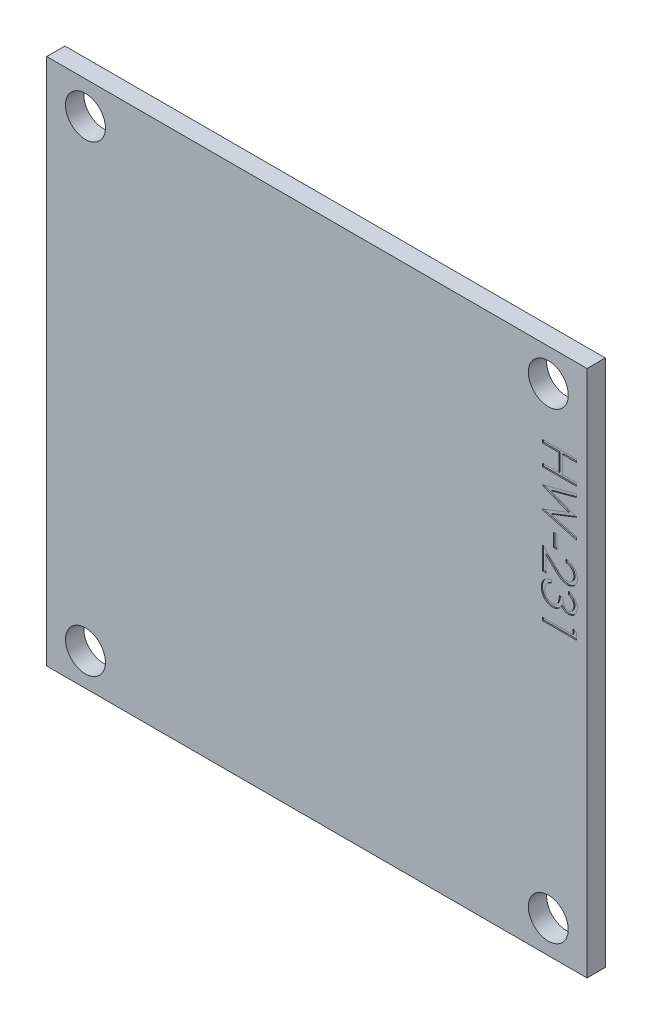
from build123d import *

# Parameters (mm, degrees)
SKETCH1_W           = 47.4
SKETCH1_H           = 46.3
BOSS_EXTRUDE1_DEPTH = 1.6
SKETCH2_R           = 1.75
CUT_EXTRUDE2_DEPTH  = 34.168848337
SKETCH3_W           = 0.307692307
SKETCH3_H           = 1.153846154
CUT_EXTRUDE3_DEPTH  = 0.1


with BuildPart() as part:
    # Sketch1 → Boss-Extrude1 (new body)
    with BuildSketch(Plane.XY):
        Rectangle(SKETCH1_W, SKETCH1_H)
    extrude(amount=BOSS_EXTRUDE1_DEPTH)

    # Sketch2 → Cut-Extrude2 (cut, through all)
    with BuildSketch(Plane.XY):
        with Locations((-20.3, 20.3)):
            Circle(SKETCH2_R)
        with Locations((20.3, 20.3)):
            Circle(SKETCH2_R)
        with Locations((20.3, -20.3)):
            Circle(SKETCH2_R)
        with Locations((-20.3, -20.3)):
            Circle(SKETCH2_R)
    extrude(amount=CUT_EXTRUDE2_DEPTH, mode=Mode.SUBTRACT)

    # Sketch3 → Cut-Extrude3 (cut)
    with BuildSketch(Plane.XY.offset(1.6)):
        Polygon((22.770044754, 15.813958066), (22.770044754, 15.544727296), (21.539275523, 15.544727296), (21.539275523, 14.006265758), (22.770044754, 14.006265758), (22.770044754, 13.737034989), (19.770044754, 13.737034989), (19.770044754, 14.006265758), (21.231583215, 14.006265758), (21.231583215, 15.544727296), (19.770044754, 15.544727296), (19.770044754, 15.813958066), align=None)
        Polygon((22.770044754, 13.160111912), (22.770044754, 12.88186672), (20.569924561, 12.294727296), (22.770044754, 11.421530181), (22.770044754, 11.382467681), (20.5849486, 10.525496527), (22.770044754, 9.935352296), (22.770044754, 9.660111912), (19.770044754, 10.469006143), (19.770044754, 10.507467681), (22.064515907, 11.410111912), (19.770044754, 12.32357345), (19.770044754, 12.362034989), align=None)
        with Locations((20.923890908, 8.660111912)):
            Rectangle(SKETCH3_W, SKETCH3_H)
        with BuildLine():
            Line((21.846967831, 7.46780422), (21.846967831, 7.737034989))
            add(Edge.make_bspline(
                [(21.846967831, 7.737034989), (21.88268591, 7.735280585), (21.952835269, 7.731834982), (22.055110411, 7.715692222), (22.152880684, 7.692615338), (22.245307887, 7.659910008), (22.333496139, 7.619521784), (22.416274403, 7.57007491), (22.494464244, 7.512623513), (22.566585269, 7.44727299), (22.632512903, 7.37636165), (22.690047258, 7.300314362), (22.738101988, 7.219912748), (22.778493096, 7.135854177), (22.808774715, 7.047166487), (22.831253049, 6.954697434), (22.84477491, 6.858029066), (22.84622854, 6.792166264), (22.846967831, 6.758669604)],
                knots=[0, 0, 0, 0, 1.100776268, 2.161895295, 3.184016182, 4.190939212, 5.176500551, 6.166955529, 7.155448256, 8.160289653, 9.16017456, 10.133824356, 11.091467644, 12.04088621, 13.000931625, 13.972173743, 14.968683325, 16, 16, 16, 16], degree=3))
            add(Edge.make_bspline(
                [(22.846967831, 6.758669604), (22.846197725, 6.725774112), (22.844684495, 6.661135645), (22.831689327, 6.566796776), (22.811335963, 6.476987666), (22.782779892, 6.391883866), (22.74439324, 6.312164382), (22.698281064, 6.237230344), (22.64494978, 6.166189649), (22.582160797, 6.102240978), (22.515130182, 6.043519767), (22.443569121, 5.992860691), (22.369658305, 5.949477979), (22.292834132, 5.913317111), (22.212373251, 5.886697563), (22.129447077, 5.866487671), (22.043197239, 5.855064173), (21.984820191, 5.853310953), (21.955140907, 5.852419604)],
                knots=[0, 0, 0, 0, 1.111607364, 2.184268762, 3.212621178, 4.221274766, 5.211760367, 6.196651075, 7.1921475, 8.207485113, 9.220403448, 10.201281604, 11.166441695, 12.114753415, 13.065576456, 14.026450734, 14.996634279, 16, 16, 16, 16], degree=3))
            add(Edge.make_bspline(
                [(21.955140907, 5.852419604), (21.913357049, 5.853870972), (21.83052258, 5.856748239), (21.708795555, 5.881360562), (21.590858339, 5.919800429), (21.495940651, 5.966083877), (21.4194548, 6.012774544), (21.356481624, 6.05484955), (21.288676937, 6.104105103), (21.21626779, 6.161258101), (21.138687015, 6.225126277), (21.055981476, 6.296288131), (20.969005673, 6.375251116), (20.909600872, 6.430672688), (20.878818792, 6.459390758)],
                knots=[0, 0, 0, 0, 1.184426356, 2.348067706, 3.509069118, 4.696110526, 5.333549288, 6.050745305, 6.844228056, 7.710549037, 8.667450064, 9.695053472, 10.805634456, 12, 12, 12, 12], degree=3))
            Line((20.878818792, 6.459390758), (20.077737061, 7.20999172))
            Line((20.077737061, 7.20999172), (20.077737061, 5.813958066))
            Line((20.077737061, 5.813958066), (19.770044754, 5.813958066))
            Line((19.770044754, 5.813958066), (19.770044754, 7.852419604))
            Line((19.770044754, 7.852419604), (21.011631292, 6.688958066))
            add(Edge.make_bspline(
                [(21.011631292, 6.688958066), (21.041199656, 6.6606293), (21.097994433, 6.606215539), (21.180938189, 6.52928543), (21.257795905, 6.460078679), (21.328908157, 6.398549378), (21.393871804, 6.3446469), (21.453195951, 6.29854371), (21.506371495, 6.26003604), (21.568839901, 6.219225934), (21.645200642, 6.180310789), (21.738048065, 6.14610836), (21.833838574, 6.125402674), (21.89855136, 6.122906148), (21.931102446, 6.121650373)],
                knots=[0, 0, 0, 0, 1.329530082, 2.553755191, 3.672934919, 4.687409497, 5.60679272, 6.413407421, 7.126401618, 7.737995624, 8.834647426, 9.90044882, 10.943907757, 12, 12, 12, 12], degree=3))
            add(Edge.make_bspline(
                [(21.931102446, 6.121650373), (21.951574478, 6.122189698), (21.991920922, 6.123252603), (22.05103626, 6.132810942), (22.108281, 6.14685404), (22.162947354, 6.168498792), (22.216110501, 6.194504164), (22.266154117, 6.227727944), (22.314784068, 6.265694001), (22.360332874, 6.309732765), (22.402062653, 6.358079144), (22.439025363, 6.409161588), (22.469916236, 6.463204102), (22.495239178, 6.519981466), (22.515103806, 6.579334693), (22.528868299, 6.641378769), (22.537510429, 6.705942209), (22.538679719, 6.750028063), (22.539275523, 6.77249172)],
                knots=[0, 0, 0, 0, 0.991504627, 1.954065223, 2.895985987, 3.842598665, 4.797835564, 5.759220273, 6.74786863, 7.784730864, 8.824135544, 9.839918996, 10.835834653, 11.835434876, 12.84861661, 13.863796685, 14.911511676, 16, 16, 16, 16], degree=3))
            add(Edge.make_bspline(
                [(22.539275523, 6.77249172), (22.538662823, 6.795952537), (22.537459583, 6.84202571), (22.529037527, 6.909669118), (22.514522093, 6.974205162), (22.49462174, 7.035764481), (22.469567039, 7.094406387), (22.437758209, 7.14960064), (22.400437184, 7.201851145), (22.357893254, 7.251061937), (22.310302825, 7.296278933), (22.257905025, 7.336842253), (22.200359011, 7.371438478), (22.138964576, 7.402106473), (22.072089316, 7.425572029), (22.001353775, 7.44563016), (21.925752968, 7.460200909), (21.873665723, 7.465227688), (21.846967831, 7.46780422)],
                knots=[0, 0, 0, 0, 1.031212865, 2.025131798, 2.990757446, 3.934781266, 4.865570067, 5.788494791, 6.729227313, 7.684356718, 8.643577152, 9.610526866, 10.590658432, 11.59095419, 12.621640561, 13.700587263, 14.82141059, 16, 16, 16, 16], degree=3))
        make_face()
        with BuildLine():
            Line((22.077737061, 5.160111912), (22.077737061, 5.429342681))
            add(Edge.make_bspline(
                [(22.077737061, 5.429342681), (22.107936333, 5.422048781), (22.16697344, 5.407789801), (22.251322521, 5.378049024), (22.331142682, 5.345649663), (22.404939316, 5.306744716), (22.474195519, 5.264308641), (22.537340483, 5.215689165), (22.595980167, 5.163129403), (22.648020085, 5.104993732), (22.695143853, 5.044026308), (22.735322474, 4.979368062), (22.769886033, 4.912319868), (22.798360518, 4.842417182), (22.819810967, 4.769451892), (22.835373943, 4.694083644), (22.845480612, 4.616114929), (22.846466981, 4.563188423), (22.846967831, 4.536313835)],
                knots=[0, 0, 0, 0, 1.162005537, 2.271625781, 3.343758855, 4.383309926, 5.390229558, 6.379919256, 7.361854164, 8.333198761, 9.295911338, 10.242430842, 11.177959212, 12.116337295, 13.062827104, 14.020064771, 14.994644689, 16, 16, 16, 16], degree=3))
            add(Edge.make_bspline(
                [(22.846967831, 4.536313835), (22.845785633, 4.497157199), (22.843447026, 4.419698047), (22.822091794, 4.305901149), (22.788298824, 4.196163876), (22.741607058, 4.091687378), (22.684017932, 3.994643007), (22.615476729, 3.908297704), (22.537305899, 3.833821837), (22.450963701, 3.771340942), (22.35868755, 3.722419515), (22.263715987, 3.68634548), (22.166274297, 3.664384039), (22.100482344, 3.661537848), (22.067520715, 3.660111912)],
                knots=[0, 0, 0, 0, 1.083050992, 2.142477498, 3.193116406, 4.255571735, 5.30263384, 6.308962982, 7.297363603, 8.282367274, 9.249857812, 10.179914175, 11.08814088, 12, 12, 12, 12], degree=3))
            add(Edge.make_bspline(
                [(22.067520715, 3.660111912), (22.035800605, 3.661109276), (21.973729273, 3.663060962), (21.883110847, 3.679632709), (21.797703761, 3.707520935), (21.717148479, 3.74615216), (21.641955759, 3.796159203), (21.571956424, 3.8567358), (21.506840003, 3.92830951), (21.469537598, 3.9825486), (21.450333215, 4.010472489)],
                knots=[0, 0, 0, 0, 1.024540389, 2.004866551, 2.965041327, 3.920577974, 4.882998113, 5.874504559, 6.905732034, 8, 8, 8, 8], degree=3))
            add(Edge.make_bspline(
                [(21.450333215, 4.010472489), (21.434923354, 3.978559556), (21.404391962, 3.915330807), (21.344515598, 3.829144639), (21.275381586, 3.75090646), (21.221430741, 3.707274701), (21.1943236, 3.685352296)],
                knots=[0, 0, 0, 0, 1.015518401, 2.012035669, 3.001164323, 4, 4, 4, 4], degree=3))
            add(Edge.make_bspline(
                [(21.1943236, 3.685352296), (21.174561919, 3.670910984), (21.135362168, 3.642264846), (21.072300175, 3.607005949), (21.008747977, 3.574653534), (20.942206783, 3.550843093), (20.874814013, 3.530295626), (20.805126521, 3.516776077), (20.733806395, 3.508097067), (20.685534933, 3.506878357), (20.661270715, 3.506265758)],
                knots=[0, 0, 0, 0, 1.02516404, 2.033540309, 3.025129118, 4.011046665, 4.991655828, 5.976607087, 6.982917762, 8, 8, 8, 8], degree=3))
            add(Edge.make_bspline(
                [(20.661270715, 3.506265758), (20.619264053, 3.507807299), (20.535448413, 3.510883128), (20.411587881, 3.538264387), (20.290721533, 3.580957596), (20.174640215, 3.640525483), (20.066257434, 3.714226608), (19.969724266, 3.802394899), (19.886188054, 3.902886999), (19.816616641, 4.015045208), (19.760962513, 4.136506366), (19.722344622, 4.266431205), (19.697190152, 4.40293046), (19.69449294, 4.496536824), (19.693121677, 4.544126335)],
                knots=[0, 0, 0, 0, 0.95570045, 1.906903359, 2.87519758, 3.868912786, 4.869932978, 5.851730567, 6.836639976, 7.83677598, 8.849487602, 9.869908895, 10.917060885, 12, 12, 12, 12], degree=3))
            add(Edge.make_bspline(
                [(19.693121677, 4.544126335), (19.69386586, 4.576200021), (19.695330163, 4.63931034), (19.705340393, 4.732090481), (19.723623254, 4.820651938), (19.748226087, 4.90511445), (19.779419009, 4.985553053), (19.818263608, 5.061722286), (19.863959181, 5.134090766), (19.917045113, 5.201975581), (19.976429119, 5.265368639), (20.043165413, 5.32258526), (20.116020331, 5.374579368), (20.195840093, 5.419958773), (20.281593171, 5.460790446), (20.374377598, 5.494374124), (20.473363902, 5.523933182), (20.542344823, 5.537676152), (20.577737061, 5.544727296)],
                knots=[0, 0, 0, 0, 1.048658725, 2.063410685, 3.046034179, 4.001477787, 4.936774919, 5.862367409, 6.792675028, 7.730719943, 8.675894397, 9.627829632, 10.600096036, 11.597688215, 12.626045268, 13.701542398, 14.82072376, 16, 16, 16, 16], degree=3))
            Line((20.577737061, 5.544727296), (20.577737061, 5.275496527))
            add(Edge.make_bspline(
                [(20.577737061, 5.275496527), (20.554637907, 5.268482277), (20.509708046, 5.254838952), (20.445044927, 5.231615268), (20.385766595, 5.205156749), (20.331438205, 5.176772842), (20.281524717, 5.146962745), (20.237345972, 5.113607095), (20.196961513, 5.079176399), (20.174208989, 5.053222668), (20.1630736, 5.040520566)],
                knots=[0, 0, 0, 0, 1.198163088, 2.33053128, 3.407730985, 4.417276592, 5.372219308, 6.28897303, 7.162600585, 8, 8, 8, 8], degree=3))
            add(Edge.make_bspline(
                [(20.1630736, 5.040520566), (20.150123599, 5.0237235), (20.124263572, 4.990181218), (20.091262176, 4.935522734), (20.062667012, 4.878038546), (20.040823844, 4.816483111), (20.022328706, 4.752184736), (20.010225404, 4.684104137), (20.001921257, 4.612841951), (20.001188459, 4.564183868), (20.000813984, 4.539318643)],
                knots=[0, 0, 0, 0, 0.946170439, 1.889420265, 2.845303464, 3.807233317, 4.801018734, 5.828864929, 6.890507805, 8, 8, 8, 8], degree=3))
            add(Edge.make_bspline(
                [(20.000813984, 4.539318643), (20.001341045, 4.511243832), (20.002371665, 4.456345963), (20.011877123, 4.376247107), (20.025660334, 4.300021753), (20.047219954, 4.22844778), (20.073084281, 4.160551241), (20.106945432, 4.097847785), (20.145186127, 4.038494006), (20.18966741, 3.984228696), (20.237746863, 3.935305865), (20.288754877, 3.893031135), (20.341109873, 3.856416383), (20.396033187, 3.826984233), (20.452986065, 3.803702021), (20.512181682, 3.78786203), (20.573121575, 3.776845713), (20.614546489, 3.775948716), (20.635429369, 3.775496527)],
                knots=[0, 0, 0, 0, 1.216990249, 2.379719373, 3.493992396, 4.571561497, 5.616923107, 6.638958652, 7.655775068, 8.674704564, 9.676001865, 10.625896028, 11.54399481, 12.441854662, 13.322657739, 14.20572845, 15.095482574, 16, 16, 16, 16], degree=3))
            add(Edge.make_bspline(
                [(20.635429369, 3.775496527), (20.663381977, 3.776808191), (20.719148104, 3.779424992), (20.801191266, 3.799404123), (20.880241751, 3.832264646), (20.954939483, 3.878274987), (21.024203619, 3.934256654), (21.085762457, 3.999667749), (21.137068199, 4.074668724), (21.172385147, 4.144142446), (21.195922408, 4.205828449), (21.212426295, 4.258513197), (21.225619209, 4.317547554), (21.238380731, 4.382222825), (21.249079181, 4.452811777), (21.258039552, 4.529378007), (21.265197993, 4.611952319), (21.268396508, 4.66911606), (21.270044754, 4.69857345)],
                knots=[0, 0, 0, 0, 1.070481957, 2.135637345, 3.216366529, 4.339485895, 5.485746587, 6.620975969, 7.768829582, 8.956804399, 9.598399438, 10.297751078, 11.070570279, 11.915248466, 12.824061284, 13.805856426, 14.869322739, 16, 16, 16, 16], degree=3))
            Line((21.270044754, 4.69857345), (21.577737061, 4.69857345))
            add(Edge.make_bspline(
                [(21.577737061, 4.69857345), (21.578369639, 4.661459191), (21.579608704, 4.588761475), (21.594491198, 4.482551916), (21.61530985, 4.380868817), (21.646462193, 4.286033209), (21.683853897, 4.199875772), (21.726015773, 4.124716902), (21.773783287, 4.062337832), (21.826529536, 4.012582716), (21.883761115, 3.976064227), (21.94278697, 3.948653484), (22.004980436, 3.932584196), (22.047400422, 3.930426991), (22.068722638, 3.929342681)],
                knots=[0, 0, 0, 0, 1.321708579, 2.588902423, 3.815526512, 5.016621128, 6.138757764, 7.158873101, 8.079948563, 8.928590313, 9.728601868, 10.489025425, 11.240515403, 12, 12, 12, 12], degree=3))
            add(Edge.make_bspline(
                [(22.068722638, 3.929342681), (22.084389315, 3.929697849), (22.115557424, 3.930404439), (22.161092645, 3.939316998), (22.205238376, 3.952706768), (22.24779431, 3.971126642), (22.288513433, 3.995736383), (22.3274457, 4.02527627), (22.365243574, 4.05976056), (22.400098759, 4.100090501), (22.432976125, 4.143751963), (22.461397384, 4.191155774), (22.485487224, 4.241256383), (22.505390568, 4.294099864), (22.520353061, 4.349897903), (22.531098799, 4.408377286), (22.537816585, 4.469652589), (22.538783827, 4.51145691), (22.539275523, 4.532708066)],
                knots=[0, 0, 0, 0, 0.884317272, 1.759307272, 2.611736065, 3.488921043, 4.37244062, 5.294096728, 6.247679003, 7.258495569, 8.302441962, 9.333537773, 10.376747089, 11.440883505, 12.520330301, 13.637364711, 14.798958396, 16, 16, 16, 16], degree=3))
            add(Edge.make_bspline(
                [(22.539275523, 4.532708066), (22.53808524, 4.566867767), (22.535760341, 4.633589609), (22.515325527, 4.729758096), (22.482948672, 4.819067434), (22.443853714, 4.887103134), (22.405394749, 4.937428344), (22.372308502, 4.974079748), (22.334795474, 5.009415456), (22.291826726, 5.042048862), (22.244879778, 5.07393543), (22.193696065, 5.10477069), (22.13754586, 5.133564214), (22.098059417, 5.151091303), (22.077737061, 5.160111912)],
                knots=[0, 0, 0, 0, 1.4727372, 2.876598283, 4.222346151, 5.558423782, 6.24313385, 6.953189256, 7.68715613, 8.463578749, 9.278833271, 10.135787152, 11.040551781, 12, 12, 12, 12], degree=3))
        make_face()
        Polygon((22.770044754, 2.599414796), (22.770044754, 2.044727296), (19.770044754, 2.044727296), (19.770044754, 2.313958066), (22.462352446, 2.313958066), (22.462352446, 2.775496527), align=None)
    extrude(amount=-CUT_EXTRUDE3_DEPTH, mode=Mode.SUBTRACT)


solid = part.part
